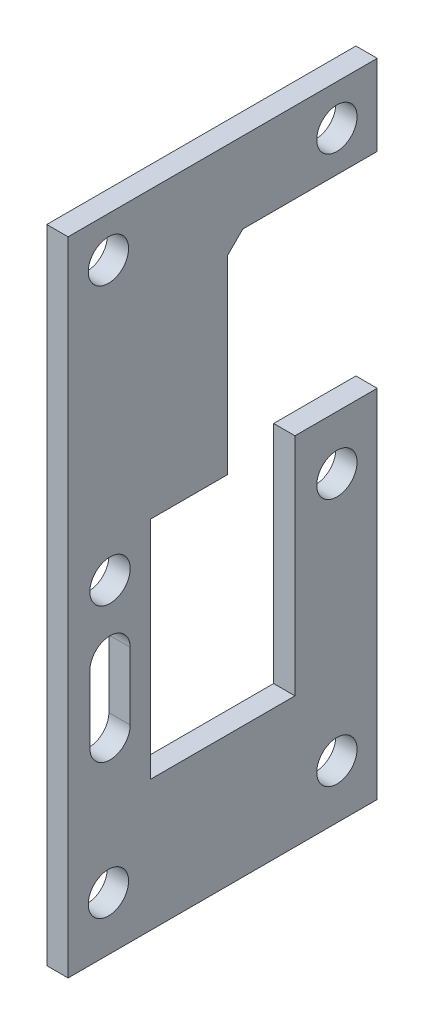
from build123d import *

# Parameters (mm, degrees)
SKETCH1_W                       = 46
SKETCH1_H                       = 95.52
BOSS_EXTRUDE1_DEPTH             = 3.175
SKETCH2_W                       = 20
SKETCH2_H                       = 30.52
CUT_EXTRUDE1_DEPTH              = 54.104597023
F_6_0MM_CLEARANCE_DOWEL_HOLE1_D = 6
F_6_0MM_DOWEL_HOLE1_D           = 6
CUT_EXTRUDE2_DEPTH              = 54.104597023
SKETCH10_W                      = 21.52
SKETCH10_H                      = 8.52
CUT_EXTRUDE3_DEPTH              = 54.104597023
SKETCH11_W                      = 21.52
SKETCH11_H                      = 25
CUT_EXTRUDE4_DEPTH              = 54.104597023
SKETCH14_R                      = 3
CUT_EXTRUDE5_DEPTH              = 54.104597023


with BuildPart() as part:
    # Sketch1 → Boss-Extrude1 (new body)
    with BuildSketch(Plane(origin=(0, 0, 0), x_dir=(0, 0, -1), z_dir=(1, 0, 0))):
        Rectangle(SKETCH1_W, SKETCH1_H)
    extrude(amount=BOSS_EXTRUDE1_DEPTH)

    # Sketch2 → Cut-Extrude1 (cut, through all)
    with BuildSketch(Plane(origin=(3.175, 0, 0), x_dir=(0, 0, -1), z_dir=(1, 0, 0))):
        with Locations((13, 20.5)):
            Rectangle(SKETCH2_W, SKETCH2_H)
    extrude(amount=-CUT_EXTRUDE1_DEPTH, mode=Mode.SUBTRACT)

    # Ø6.0mm Clearance Dowel Hole1 (through all)
    with Locations(Plane(origin=(3.175, 0, 0), x_dir=(0, 0, -1), z_dir=(1, 0, 0))):
        with Locations((17, -2.76), (17, -39.76)):
            Hole(F_6_0MM_CLEARANCE_DOWEL_HOLE1_D / 2)

    # Ø6.0mm Dowel Hole1 (through all)
    with Locations(Plane(origin=(3.175, 0, 0), x_dir=(0, 0, -1), z_dir=(1, 0, 0))):
        with Locations((17, 41.76), (-17, 41.76), (-17, -39.76)):
            Hole(F_6_0MM_DOWEL_HOLE1_D / 2)

    # Sketch9 → Cut-Extrude2 (cut, through all)
    with BuildSketch(Plane(origin=(3.175, 0, 0), x_dir=(0, 0, -1), z_dir=(1, 0, 0))):
        Polygon((3, 35.76), (0.701902961, 33.461902961), (0.701902961, 5.24), (3, 5.24), align=None)
    extrude(amount=-CUT_EXTRUDE2_DEPTH, mode=Mode.SUBTRACT)

    # Sketch10 → Cut-Extrude3 (cut, through all)
    with BuildSketch(Plane(origin=(3.175, 0, 0), x_dir=(0, 0, -1), z_dir=(1, 0, 0))):
        with Locations((0, 0.98)):
            Rectangle(SKETCH10_W, SKETCH10_H)
    extrude(amount=-CUT_EXTRUDE3_DEPTH, mode=Mode.SUBTRACT)

    # Sketch11 → Cut-Extrude4 (cut, through all)
    with BuildSketch(Plane(origin=(3.175, 0, 0), x_dir=(0, 0, -1), z_dir=(1, 0, 0))):
        with Locations((0, -15.78)):
            Rectangle(SKETCH11_W, SKETCH11_H)
    extrude(amount=-CUT_EXTRUDE4_DEPTH, mode=Mode.SUBTRACT)

    # Sketch14 → Cut-Extrude5 (cut, through all)
    with BuildSketch(Plane(origin=(3.175, 0, 0), x_dir=(0, 0, -1), z_dir=(1, 0, 0))):
        with Locations((-16.76, 0.39)):
            Circle(SKETCH14_R)
        with BuildLine():
            Line((-13.76, -9.77), (-13.76, -19.77))
            ThreePointArc((-13.76, -19.77), (-16.76, -22.77), (-19.76, -19.77))
            Line((-19.76, -19.77), (-19.76, -9.77))
            ThreePointArc((-19.76, -9.77), (-16.76, -6.77), (-13.76, -9.77))
        make_face()
    extrude(amount=-CUT_EXTRUDE5_DEPTH, mode=Mode.SUBTRACT)


solid = part.part
